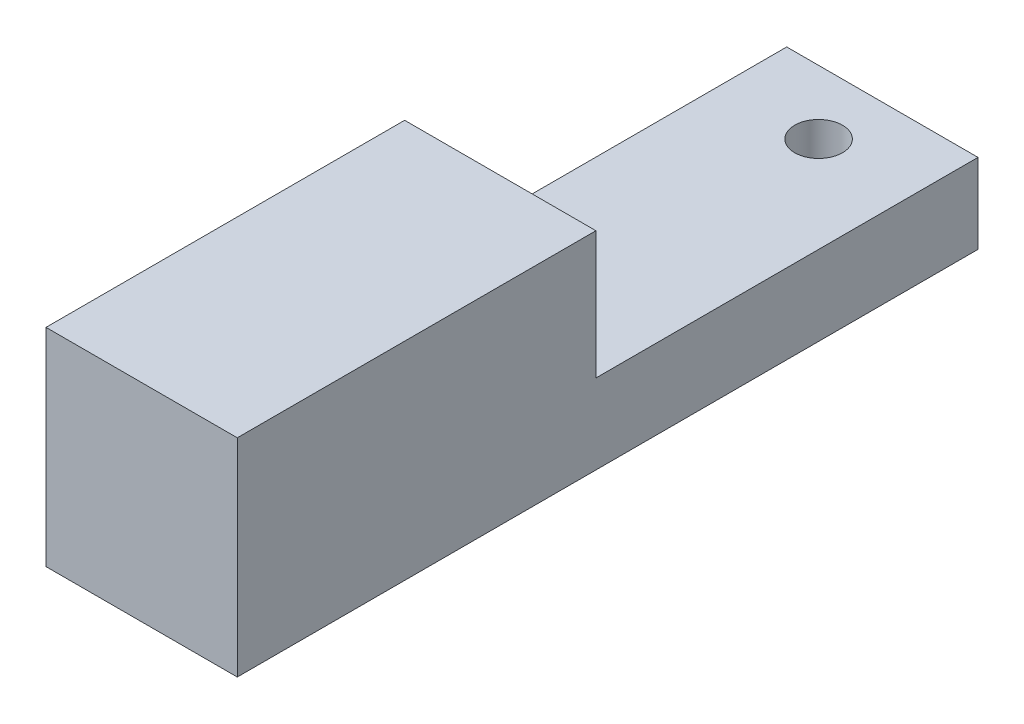
from build123d import *

# Parameters (mm, degrees)
SKETCH1_W           = 12
SKETCH1_H           = 46.47
SKETCH1_R           = 1.5
BOSS_EXTRUDE1_DEPTH = 5
SKETCH2_W           = 12
SKETCH2_H           = 22.5
BOSS_EXTRUDE2_DEPTH = 8


with BuildPart() as part:
    # Sketch1 → Boss-Extrude1 (new body)
    with BuildSketch(Plane(origin=(0, 0, 0), x_dir=(1, 0, 0), z_dir=(0, 1, 0))):
        Rectangle(SKETCH1_W, SKETCH1_H)
        with Locations(Location((0, 19.235, 0), (0, 0, 270))):
            Circle(SKETCH1_R, mode=Mode.SUBTRACT)
        with Locations(Location((0, 1.765, 0), (0, 0, 270))):
            Circle(SKETCH1_R, mode=Mode.SUBTRACT)
    extrude(amount=-BOSS_EXTRUDE1_DEPTH)

    # Sketch2 → Boss-Extrude2 (add)
    with BuildSketch(Plane(origin=(0, 0, 0), x_dir=(1, 0, 0), z_dir=(0, 1, 0))):
        with Locations((0, -11.985)):
            Rectangle(SKETCH2_W, SKETCH2_H)
    extrude(amount=BOSS_EXTRUDE2_DEPTH)


solid = part.part
